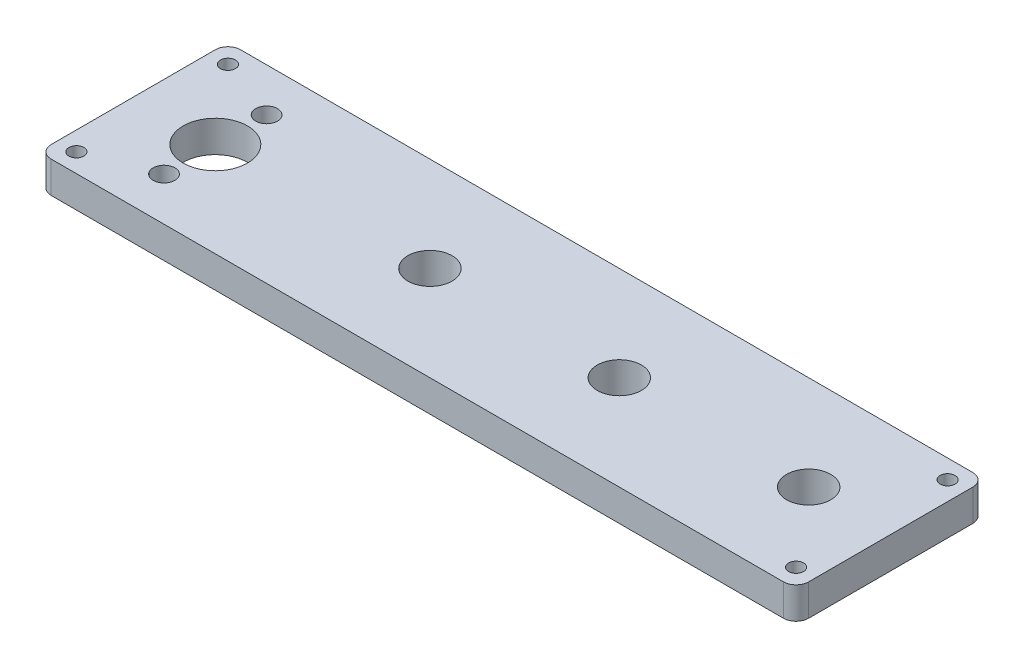
from build123d import *

# Parameters (mm, degrees)
SKETCH1_R             = 4.445
SKETCH1_R_2           = 6.477
SKETCH1_R_3           = 2.19075
BOSS_EXTRUDE1_DEPTH   = 6.35
F_1_0MM_DOWEL_HOLE2_D = 3.0226


with BuildPart() as part:
    # Sketch1 → Boss-Extrude1 (new body)
    with BuildSketch(Plane.XZ):
        with BuildLine():
            Line((-35.56, -19.05), (111.76, -19.05))
            ThreePointArc((111.76, -19.05), (113.556051224, -18.306051224), (114.3, -16.51))
            Line((114.3, -16.51), (114.3, 16.51))
            ThreePointArc((114.3, 16.51), (113.556051224, 18.306051224), (111.76, 19.05))
            Line((111.76, 19.05), (-35.56, 19.05))
            ThreePointArc((-35.56, 19.05), (-37.356051224, 18.306051224), (-38.1, 16.51))
            Line((-38.1, 16.51), (-38.1, -16.51))
            ThreePointArc((-38.1, -16.51), (-37.356051224, -18.306051224), (-35.56, -19.05))
        make_face()
        with Locations(Location((59.69, 0, 0), (0, 0, 270))):
            Circle(SKETCH1_R, mode=Mode.SUBTRACT)
        with Locations(Location((97.79, 0, 0), (0, 0, 270))):
            Circle(SKETCH1_R, mode=Mode.SUBTRACT)
        with Locations(Location((-21.59, 0, 0), (0, 0, 270))):
            Circle(SKETCH1_R_2, mode=Mode.SUBTRACT)
        with Locations(Location((-21.59, -10.31875, 0), (0, 0, 270))):
            Circle(SKETCH1_R_3, mode=Mode.SUBTRACT)
        with Locations(Location((-21.59, 10.31875, 0), (0, 0, 270))):
            Circle(SKETCH1_R_3, mode=Mode.SUBTRACT)
        with Locations(Location((21.59, 0, 0), (0, 0, 90))):
            Circle(SKETCH1_R, mode=Mode.SUBTRACT)
    extrude(amount=-BOSS_EXTRUDE1_DEPTH)

    # Ø1.0mm Dowel Hole2 (through all)
    with Locations(Plane(origin=(0, 6.35, 0), x_dir=(1, 0, 0), z_dir=(0, 1, 0))):
        with Locations((-34.29, 15.24), (110.49, 15.24), (110.49, -15.24), (-34.29, -15.24)):
            Hole(F_1_0MM_DOWEL_HOLE2_D / 2)


solid = part.part
